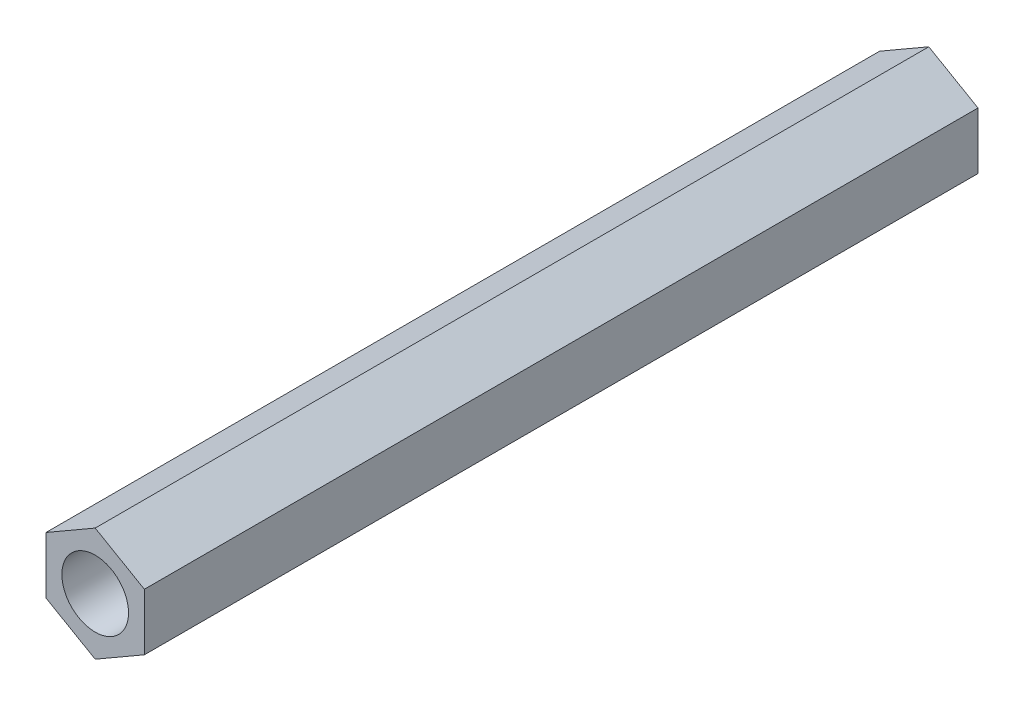
from build123d import *

# Parameters (mm, degrees)
SKETCH_1_R      = 2
EXTRUDE_1_DEPTH = 50


with BuildPart() as part:
    # 草图1 → 凸台-拉伸1 (new body)
    with BuildSketch(Plane.XY):
        Polygon((2.95, -1.703183294), (2.95, 1.703183294), (0, 3.406366588), (-2.95, 1.703183294), (-2.95, -1.703183294), (0, -3.406366588), align=None)
        Circle(SKETCH_1_R, mode=Mode.SUBTRACT)
    extrude(amount=EXTRUDE_1_DEPTH)


solid = part.part
